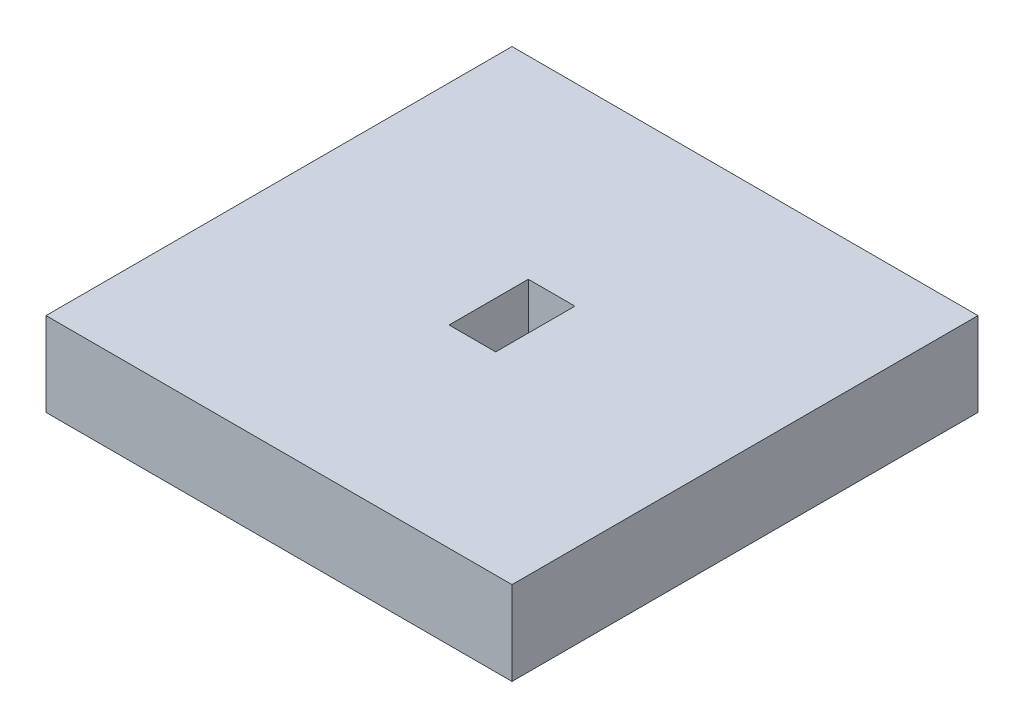
from build123d import *

# Parameters (mm, degrees)
SKETCH_1_W               = 100
SKETCH_1_H               = 100
EXTRUDE_1_DEPTH          = 18
CUT_EXTRUDE_1_DEPTH      = 73.965745388
CUT_EXTRUDE_1_DEPTH_BACK = 73.965745388
SKETCH_2_W               = 10
SKETCH_2_H               = 17


with BuildPart() as part:
    # Эскиз1 → Бобышка-Вытянуть1 (new body)
    with BuildSketch(Plane(origin=(0, 0, 0), x_dir=(1, 0, 0), z_dir=(0, 1, 0))):
        Rectangle(SKETCH_1_W, SKETCH_1_H)
    extrude(amount=EXTRUDE_1_DEPTH)

    # Эскиз2 → Вырез-Вытянуть1 (cut, two sides: drawn at the far end of the back side and taken through both)
    with BuildSketch(Plane(origin=(0, 18, 0), x_dir=(1, 0, 0), z_dir=(0, 1, 0)).offset(-CUT_EXTRUDE_1_DEPTH_BACK)):
        Rectangle(SKETCH_2_W, SKETCH_2_H)
    extrude(amount=CUT_EXTRUDE_1_DEPTH + CUT_EXTRUDE_1_DEPTH_BACK, mode=Mode.SUBTRACT)


solid = part.part
